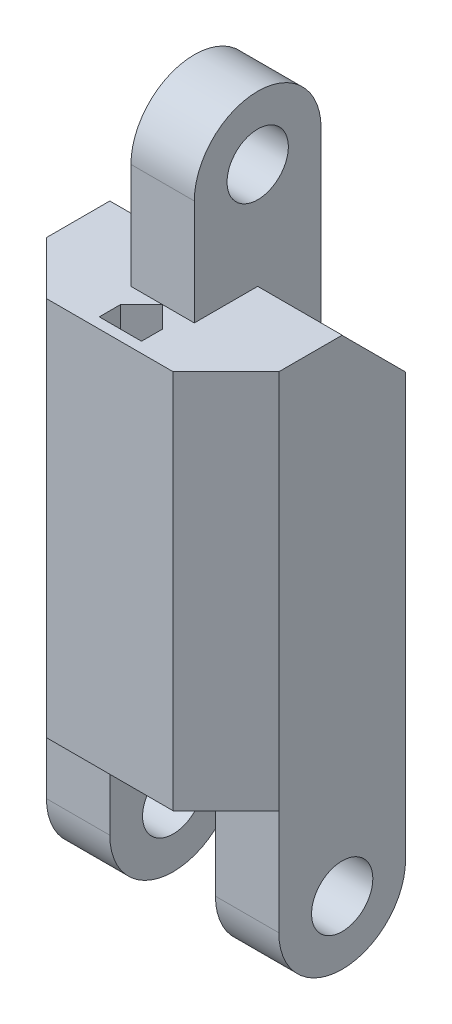
from build123d import *

# Parameters (mm, degrees)
BOSS_EXTRUDE1_DEPTH     = 9
CUT_EXTRUDE2_DEPTH      = 12.895377253
SKETCH6_W               = 3
SKETCH6_H               = 6
BOSS_EXTRUDE3_DEPTH     = 5
SKETCH7_W               = 3
SKETCH7_H               = 3
REVOLVE1_ANGLE          = 180
SKETCH9_R               = 1.45
CUT_EXTRUDE3_DEPTH      = 5
SKETCH10_W              = 3
SKETCH10_H              = 6
BOSS_EXTRUDE4_DEPTH     = 5
SKETCH12_W              = 3
SKETCH12_H              = 3
REVOLVE2_ANGLE          = 180
SKETCH14_R              = 1.45
CUT_EXTRUDE4_DEPTH      = 5
CUT_EXTRUDE5_DEPTH      = 19.694919096
CUT_EXTRUDE5_DEPTH_BACK = 19.694919096


with BuildPart() as part:
    # Sketch2 → Boss-Extrude1 (new, symmetric)
    with BuildSketch(Plane(origin=(0, 0, 0), x_dir=(1, 0, 0), z_dir=(0, 1, 0))):
        Polygon((-3, 5.5), (3, 5.5), (5.5, 3), (5.5, -3), (3, -5.5), (-3, -5.5), (-5.5, -3), (-5.5, 3), align=None)
    extrude(amount=BOSS_EXTRUDE1_DEPTH, both=True)

    # Sketch5 → Cut-Extrude2 (cut, symmetric)
    with BuildSketch(Plane(origin=(0, 0, 0), x_dir=(0, 0, -1), z_dir=(1, 0, 0))):
        Polygon((0, 9), (0, 8.99), (5.5, 3.49), (5.5, 9), align=None)
    cut_extrude2 = extrude(amount=CUT_EXTRUDE2_DEPTH, both=True, mode=Mode.SUBTRACT)

    # Mirror3: Cut-Extrude2 across plane
    add(cut_extrude2.mirror(Plane.ZX), mode=Mode.SUBTRACT)

    # Sketch6 → Boss-Extrude3 (add, symmetric)
    with BuildSketch(Plane.XZ.offset(9)):
        with Locations((-4, 0)):
            Rectangle(SKETCH6_W, SKETCH6_H)
    boss_extrude3 = extrude(amount=BOSS_EXTRUDE3_DEPTH, both=True)

    # Sketch7 → Revolve1 (revolve)
    with BuildSketch(Plane.XZ.offset(14)):
        with Locations((-4, 1.5)):
            Rectangle(SKETCH7_W, SKETCH7_H)
    revolve1 = revolve(axis=Axis((-5.5, -14, 0), (1, 0, 0)), revolution_arc=REVOLVE1_ANGLE)

    # Sketch9 → Cut-Extrude3 (cut, symmetric)
    with BuildSketch(Plane.ZY.offset(5.5)):
        with Locations((0, -14)):
            Circle(SKETCH9_R)
    cut_extrude3 = extrude(amount=CUT_EXTRUDE3_DEPTH, both=True, mode=Mode.SUBTRACT)

    # Mirror5: Boss-Extrude3, Revolve1, Cut-Extrude3 across plane
    add(boss_extrude3.mirror(Plane(origin=(0, 0, 0), x_dir=(0, 0, 1), z_dir=(1, 0, 0))))
    add(revolve1.mirror(Plane(origin=(0, 0, 0), x_dir=(0, 0, 1), z_dir=(1, 0, 0))))
    add(cut_extrude3.mirror(Plane(origin=(0, 0, 0), x_dir=(0, 0, 1), z_dir=(1, 0, 0))), mode=Mode.SUBTRACT)

    # Sketch10 → Boss-Extrude4 (add, symmetric)
    with BuildSketch(Plane(origin=(0, 9, 0), x_dir=(1, 0, 0), z_dir=(0, 1, 0))):
        Rectangle(SKETCH10_W, SKETCH10_H)
    extrude(amount=BOSS_EXTRUDE4_DEPTH, both=True)

    # Sketch12 → Revolve2 (revolve)
    with BuildSketch(Plane(origin=(0, 14, 0), x_dir=(1, 0, 0), z_dir=(0, 1, 0))):
        with Locations((0, 1.5)):
            Rectangle(SKETCH12_W, SKETCH12_H)
    revolve(axis=Axis((-1.5, 14, 0), (1, 0, 0)), revolution_arc=REVOLVE2_ANGLE)

    # Sketch14 → Cut-Extrude4 (cut, symmetric)
    with BuildSketch(Plane.ZY.offset(1.5)):
        with Locations((0, 14)):
            Circle(SKETCH14_R)
    extrude(amount=CUT_EXTRUDE4_DEPTH, both=True, mode=Mode.SUBTRACT)

    # Sketch15 → Cut-Extrude5 (cut, two sides: drawn at the far end of the back side and taken through both)
    with BuildSketch(Plane(origin=(0, 0, 0), x_dir=(1, 0, 0), z_dir=(0, 1, 0)).offset(-CUT_EXTRUDE5_DEPTH_BACK)):
        Polygon((0, 5), (-1, 4), (-1, 3), (1, 3), (1, 4), align=None)
        Polygon((1, -4), (0, -3), (-1, -4), (-1, -5), (1, -5), align=None)
    extrude(amount=CUT_EXTRUDE5_DEPTH + CUT_EXTRUDE5_DEPTH_BACK, mode=Mode.SUBTRACT)


solid = part.part
